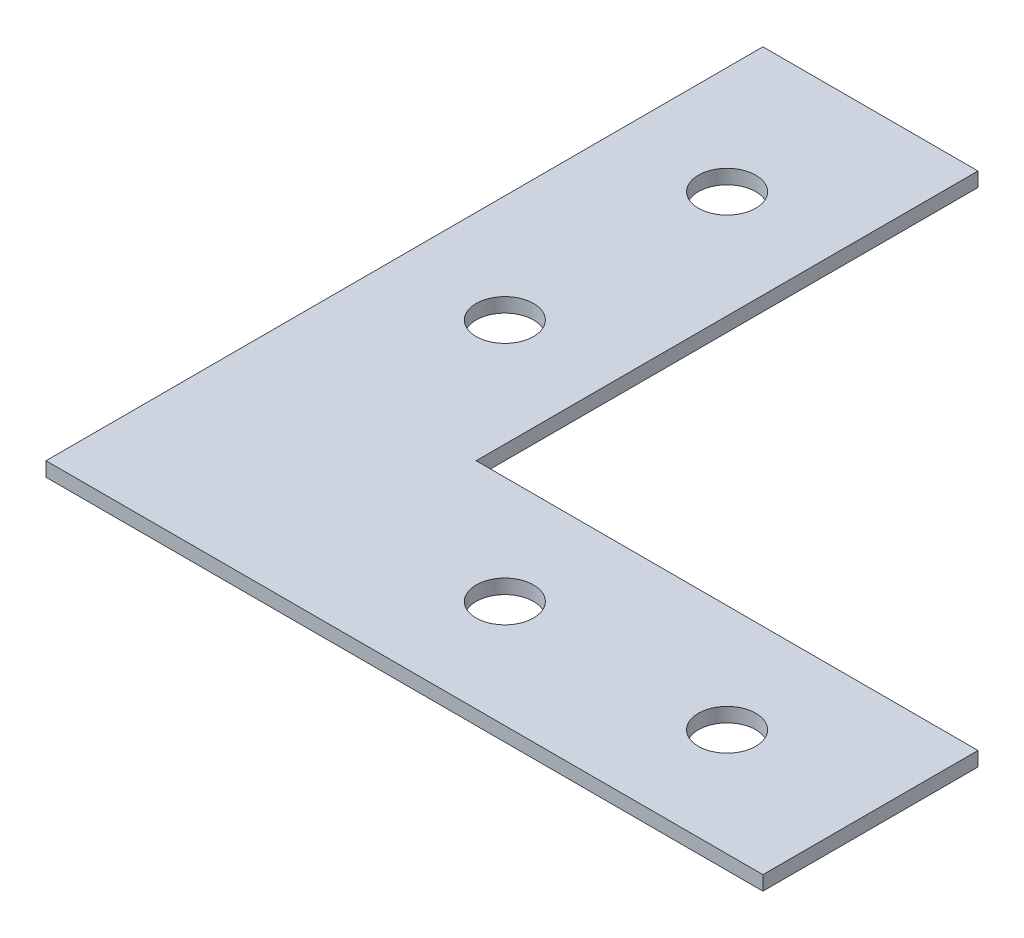
from build123d import *

# Parameters (mm, degrees)
BOSS_EXTRUDE1_DEPTH = 1
SKETCH4_R           = 2
CUT_EXTRUDE1_DEPTH  = 71.717748833


with BuildPart() as part:
    # Sketch2 → Boss-Extrude1 (new body)
    with BuildSketch(Plane(origin=(0, 0, 0), x_dir=(1, 0, 0), z_dir=(0, 1, 0))):
        Polygon((0, 0), (0, 50), (15, 50), (15, 15), (50, 15), (50, 0), align=None)
    extrude(amount=BOSS_EXTRUDE1_DEPTH)

    # Sketch4 → Cut-Extrude1 (cut, through all)
    with BuildSketch(Plane(origin=(0, 1, 0), x_dir=(1, 0, 0), z_dir=(0, 1, 0))):
        with Locations(Location((7.5, 40, 0), (0, 0, 270))):
            Circle(SKETCH4_R)
        with Locations(Location((7.5, 24.5, 0), (0, 0, 270))):
            Circle(SKETCH4_R)
        with Locations(Location((24.5, 7.5, 0), (0, 0, 270))):
            Circle(SKETCH4_R)
        with Locations(Location((40, 7.5, 0), (0, 0, 270))):
            Circle(SKETCH4_R)
    extrude(amount=-CUT_EXTRUDE1_DEPTH, mode=Mode.SUBTRACT)


solid = part.part
